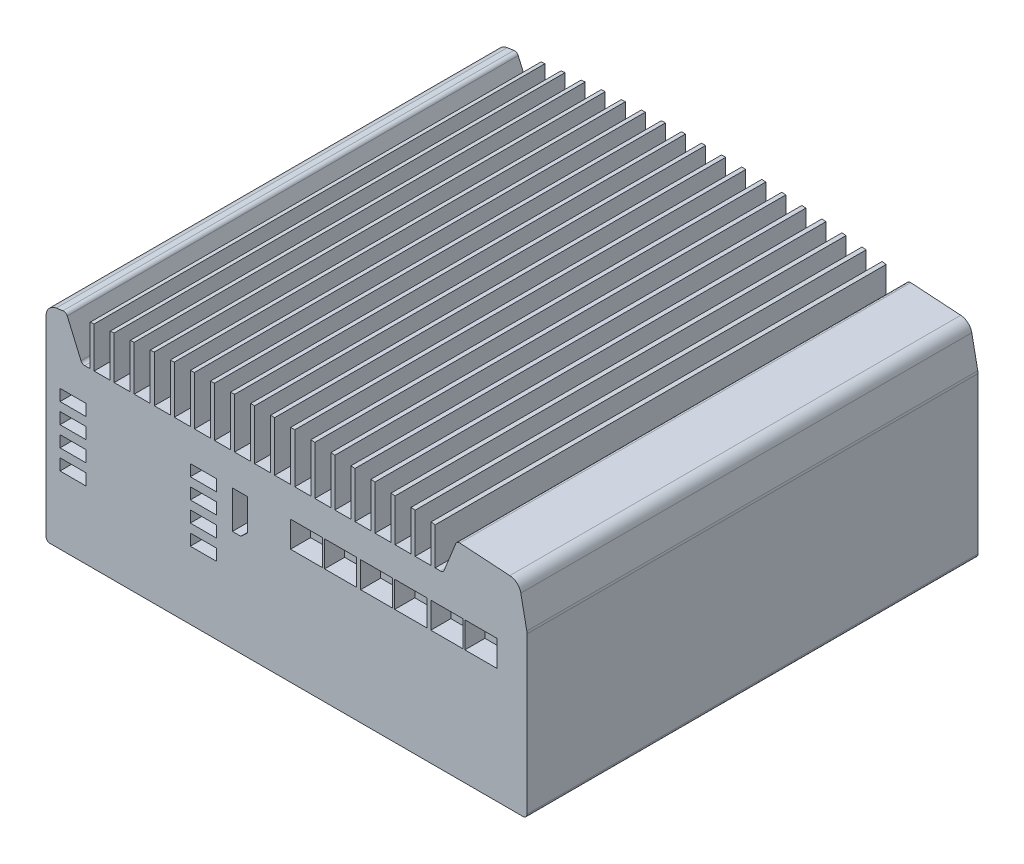
from build123d import *

# Parameters (mm, degrees)
ESQUISSE1_W             = 13
ESQUISSE1_H             = 5.7
ESQUISSE1_W_2           = 16
ESQUISSE1_H_2           = 13
BOSS_EXTRU_1_DEPTH      = 10
CONG_1_R                = 6
CONG_2_R                = 2
BOSS_EXTRU_2_START      = 215
BOSS_EXTRU_2_DEPTH      = 215
ESQUISSE3_R             = 1.6
ESQUISSE3_W             = 24
ESQUISSE3_H             = 8
ENL_V_MAT_EXTRU_1_DEPTH = 10
CONG_3_R                = 2
ESQUISSE4_R             = 1.65
ENL_V_MAT_EXTRU_2_DEPTH = 10


with BuildPart() as part:
    # Esquisse1 → Boss.-Extru.1 (new body)
    with BuildSketch(Plane.XY):
        Polygon((0, 0), (0, 102.5), (10, 103.992224963), (18, 85.5), (22, 85.5), (22, 105.577138524), (24, 105.81957608), (24, 85.5), (32, 85.5), (32, 106.727539399), (34.003461675, 106.939476386), (34.003461675, 85.5), (42.003461675, 85.5), (42.003461675, 107.724257974), (44.00991635, 107.905684552), (44.00991635, 85.5), (52.00991635, 85.5), (52.00991635, 108.567798245), (54.018896892, 108.718705997), (54.018896892, 85.5), (62.018896892, 85.5), (62.018896892, 109.258583137), (64.029937459, 109.378965072), (64.029937459, 85.5), (72.029937459, 85.5), (72.029937459, 109.796955904), (74.042573255, 109.886806448), (74.042573255, 85.5), (82.042573255, 85.5), (82.042573255, 110.183181243), (84.056340297, 110.242496239), (84.056340297, 85.5), (92.056340297, 85.5), (92.056340297, 110.417446158), (94.070775173, 110.446222863), (94.070775173, 85.5), (102.070775173, 85.5), (102.070775173, 110.499860564), (104.085414808, 110.498097647), (104.085414808, 85.5), (112.085414808, 85.5), (112.085414808, 110.430457642), (114.099796232, 110.398155185), (114.099796232, 85.5), (122.099796232, 85.5), (122.099796232, 110.209193951), (124.113456342, 110.146353446), (124.113456342, 85.5), (132.113456342, 85.5), (132.113456342, 109.835949284), (134.125931673, 109.742573639), (134.125931673, 85.5), (142.125931673, 85.5), (142.125931673, 109.310526291), (144.136758159, 109.186619826), (144.136758159, 85.5), (152.136758159, 85.5), (152.136758159, 108.632649837), (154.145470898, 108.47821829), (154.145470898, 85.5), (162.145470898, 85.5), (162.145470898, 107.801966114), (164.151603909, 107.61701664), (164.151603909, 85.5), (172.151603909, 85.5), (172.151603909, 106.818041488), (174.154689895, 106.602582667), (174.154689895, 85.5), (182.154689895, 85.5), (182.154689895, 105.680361076), (184.154259986, 105.434402916), (184.154259986, 85.5), (192.154259986, 85.5), (192.154259986, 104.388327046), (194.149843496, 104.111880985), (194.149843496, 85.5), (198.149843496, 85.5), (205, 102.5), (236, 100.5), (240, 80.5), (240, 0), align=None)
        with Locations((78.5, 66.65)):
            Rectangle(ESQUISSE1_W, ESQUISSE1_H, mode=Mode.SUBTRACT)
        with Locations((130, 64)):
            Rectangle(ESQUISSE1_W_2, ESQUISSE1_H_2, mode=Mode.SUBTRACT)
        with Locations((147, 64)):
            Rectangle(ESQUISSE1_W_2, ESQUISSE1_H_2, mode=Mode.SUBTRACT)
        with Locations((165, 64)):
            Rectangle(ESQUISSE1_W_2, ESQUISSE1_H_2, mode=Mode.SUBTRACT)
        with Locations((182, 64)):
            Rectangle(ESQUISSE1_W_2, ESQUISSE1_H_2, mode=Mode.SUBTRACT)
        with Locations((200, 64)):
            Rectangle(ESQUISSE1_W_2, ESQUISSE1_H_2, mode=Mode.SUBTRACT)
        with Locations((217, 64)):
            Rectangle(ESQUISSE1_W_2, ESQUISSE1_H_2, mode=Mode.SUBTRACT)
        with Locations((13.5, 66.65)):
            Rectangle(ESQUISSE1_W, ESQUISSE1_H, mode=Mode.SUBTRACT)
        with Locations((78.5, 56.65)):
            Rectangle(ESQUISSE1_W, ESQUISSE1_H, mode=Mode.SUBTRACT)
        with Locations((78.5, 46.65)):
            Rectangle(ESQUISSE1_W, ESQUISSE1_H, mode=Mode.SUBTRACT)
        with Locations((78.5, 36.65)):
            Rectangle(ESQUISSE1_W, ESQUISSE1_H, mode=Mode.SUBTRACT)
        with Locations((13.5, 56.65)):
            Rectangle(ESQUISSE1_W, ESQUISSE1_H, mode=Mode.SUBTRACT)
        with Locations((13.5, 46.65)):
            Rectangle(ESQUISSE1_W, ESQUISSE1_H, mode=Mode.SUBTRACT)
        with Locations((13.5, 36.65)):
            Rectangle(ESQUISSE1_W, ESQUISSE1_H, mode=Mode.SUBTRACT)
        Polygon((93, 69.5), (93, 50.7), (97.2, 50.7), (100.6, 53.8), (100.6, 69.5), align=None, mode=Mode.SUBTRACT)
    extrude(amount=-BOSS_EXTRU_1_DEPTH)

    # Congé1
    cong_1_edges = [part.edges().sort_by_distance(p)[0] for p in [
        (236, 100.5, -5),
        (240, 80.5, -5),
        (0, 102.5, -5),
    ]]
    fillet(cong_1_edges, radius=CONG_1_R)

    # Congé2
    cong_2_edges = [part.edges().sort_by_distance(p)[0] for p in [
        (10, 103.992224963, -5),
        (18, 85.5, -5),
        (198.149843496, 85.5, -5),
        (205, 102.5, -5),
        (240, 0, -5),
        (0, 0, -5),
    ]]
    fillet(cong_2_edges, radius=CONG_2_R)

    # Esquisse2 → Boss.-Extru.2 (add)
    with BuildSketch(Plane(origin=(0, 0, -10), x_dir=(-1, 0, 0), z_dir=(0, 0, -1)).offset(BOSS_EXTRU_2_START)):
        with BuildLine():
            Line((-238, 0), (-2, 0))
            ThreePointArc((-2, 0), (-0.585786438, 0.585786438), (0, 2))
            Line((0, 2), (0, 97.32890071))
            ThreePointArc((0, 97.32890071), (-1.455047837, 101.245967194), (-5.114469946, 103.263193972))
            Line((-5.114469946, 103.263193972), (-8.479594606, 103.765346274))
            ThreePointArc((-8.479594606, 103.765346274), (-9.746203645, 103.53548168), (-10.610363757, 102.581351975))
            Line((-10.610363757, 102.581351975), (-17.478311973, 86.705896545))
            ThreePointArc((-17.478311973, 86.705896545), (-18.21577123, 85.828442805), (-19.313904439, 85.5))
            Line((-19.313904439, 85.5), (-22, 85.5))
            Line((-22, 85.5), (-22, 105.577138524))
            Line((-22, 105.577138524), (-24, 105.81957608))
            Line((-24, 105.81957608), (-24, 85.5))
            Line((-24, 85.5), (-32, 85.5))
            Line((-32, 85.5), (-32, 106.727539399))
            Line((-32, 106.727539399), (-34.003461675, 106.939476386))
            Line((-34.003461675, 106.939476386), (-34.003461675, 85.5))
            Line((-34.003461675, 85.5), (-42.003461675, 85.5))
            Line((-42.003461675, 85.5), (-42.003461675, 107.724257974))
            Line((-42.003461675, 107.724257974), (-44.00991635, 107.905684552))
            Line((-44.00991635, 107.905684552), (-44.00991635, 85.5))
            Line((-44.00991635, 85.5), (-52.00991635, 85.5))
            Line((-52.00991635, 85.5), (-52.00991635, 108.567798245))
            Line((-52.00991635, 108.567798245), (-54.018896892, 108.718705997))
            Line((-54.018896892, 108.718705997), (-54.018896892, 85.5))
            Line((-54.018896892, 85.5), (-62.018896892, 85.5))
            Line((-62.018896892, 85.5), (-62.018896892, 109.258583137))
            Line((-62.018896892, 109.258583137), (-64.029937459, 109.378965072))
            Line((-64.029937459, 109.378965072), (-64.029937459, 85.5))
            Line((-64.029937459, 85.5), (-72.029937459, 85.5))
            Line((-72.029937459, 85.5), (-72.029937459, 109.796955904))
            Line((-72.029937459, 109.796955904), (-74.042573255, 109.886806448))
            Line((-74.042573255, 109.886806448), (-74.042573255, 85.5))
            Line((-74.042573255, 85.5), (-82.042573255, 85.5))
            Line((-82.042573255, 85.5), (-82.042573255, 110.183181243))
            Line((-82.042573255, 110.183181243), (-84.056340297, 110.242496239))
            Line((-84.056340297, 110.242496239), (-84.056340297, 85.5))
            Line((-84.056340297, 85.5), (-92.056340297, 85.5))
            Line((-92.056340297, 85.5), (-92.056340297, 110.417446158))
            Line((-92.056340297, 110.417446158), (-94.070775173, 110.446222863))
            Line((-94.070775173, 110.446222863), (-94.070775173, 85.5))
            Line((-94.070775173, 85.5), (-102.070775173, 85.5))
            Line((-102.070775173, 85.5), (-102.070775173, 110.499860564))
            Line((-102.070775173, 110.499860564), (-104.085414808, 110.498097647))
            Line((-104.085414808, 110.498097647), (-104.085414808, 85.5))
            Line((-104.085414808, 85.5), (-112.085414808, 85.5))
            Line((-112.085414808, 85.5), (-112.085414808, 110.430457642))
            Line((-112.085414808, 110.430457642), (-114.099796232, 110.398155185))
            Line((-114.099796232, 110.398155185), (-114.099796232, 85.5))
            Line((-114.099796232, 85.5), (-122.099796232, 85.5))
            Line((-122.099796232, 85.5), (-122.099796232, 110.209193951))
            Line((-122.099796232, 110.209193951), (-124.113456342, 110.146353446))
            Line((-124.113456342, 110.146353446), (-124.113456342, 85.5))
            Line((-124.113456342, 85.5), (-132.113456342, 85.5))
            Line((-132.113456342, 85.5), (-132.113456342, 109.835949284))
            Line((-132.113456342, 109.835949284), (-134.125931673, 109.742573639))
            Line((-134.125931673, 109.742573639), (-134.125931673, 85.5))
            Line((-134.125931673, 85.5), (-142.125931673, 85.5))
            Line((-142.125931673, 85.5), (-142.125931673, 109.310526291))
            Line((-142.125931673, 109.310526291), (-144.136758159, 109.186619826))
            Line((-144.136758159, 109.186619826), (-144.136758159, 85.5))
            Line((-144.136758159, 85.5), (-152.136758159, 85.5))
            Line((-152.136758159, 85.5), (-152.136758159, 108.632649837))
            Line((-152.136758159, 108.632649837), (-154.145470898, 108.47821829))
            Line((-154.145470898, 108.47821829), (-154.145470898, 85.5))
            Line((-154.145470898, 85.5), (-162.145470898, 85.5))
            Line((-162.145470898, 85.5), (-162.145470898, 107.801966114))
            Line((-162.145470898, 107.801966114), (-164.151603909, 107.61701664))
            Line((-164.151603909, 107.61701664), (-164.151603909, 85.5))
            Line((-164.151603909, 85.5), (-172.151603909, 85.5))
            Line((-172.151603909, 85.5), (-172.151603909, 106.818041488))
            Line((-172.151603909, 106.818041488), (-174.154689895, 106.602582667))
            Line((-174.154689895, 106.602582667), (-174.154689895, 85.5))
            Line((-174.154689895, 85.5), (-182.154689895, 85.5))
            Line((-182.154689895, 85.5), (-182.154689895, 105.680361076))
            Line((-182.154689895, 105.680361076), (-184.154259986, 105.434402916))
            Line((-184.154259986, 105.434402916), (-184.154259986, 85.5))
            Line((-184.154259986, 85.5), (-192.154259986, 85.5))
            Line((-192.154259986, 85.5), (-192.154259986, 104.388327046))
            Line((-192.154259986, 104.388327046), (-194.149843496, 104.111880985))
            Line((-194.149843496, 104.111880985), (-194.149843496, 85.5))
            Line((-194.149843496, 85.5), (-196.799479889, 85.5))
            ThreePointArc((-196.799479889, 85.5), (-197.918632614, 85.842442406), (-198.654539988, 86.752502823))
            Line((-198.654539988, 86.752502823), (-204.459454856, 101.158531752))
            ThreePointArc((-204.459454856, 101.158531752), (-205.249329218, 102.103777717), (-206.443279511, 102.406885193))
            Line((-206.443279511, 102.406885193), (-231.405699323, 100.796406495))
            ThreePointArc((-231.405699323, 100.796406495), (-234.9708117, 99.323983684), (-236.90288971, 95.985551452))
            Line((-236.90288971, 95.985551452), (-239.883484054, 81.082579729))
            ThreePointArc((-239.883484054, 81.082579729), (-239.97079996, 80.497108626), (-240, 79.905882918))
            Line((-240, 79.905882918), (-240, 2))
            ThreePointArc((-240, 2), (-239.414213562, 0.585786438), (-238, 0))
        make_face()
    extrude(amount=-BOSS_EXTRU_2_DEPTH)

    # Esquisse3 → Enlèv. mat.-Extru.1 (cut)
    with BuildSketch(Plane(origin=(0, 0, -225), x_dir=(-1, 0, 0), z_dir=(0, 0, -1))):
        with Locations((-37, 65.5)):
            Circle(ESQUISSE3_R)
        with Locations(Location((-62, 65.5, 0), (0, 0, 180))):
            Circle(ESQUISSE3_R)
        with Locations((-69, 65.5)):
            Circle(ESQUISSE3_R)
        with Locations(Location((-94, 65.5, 0), (0, 0, 180))):
            Circle(ESQUISSE3_R)
        with Locations(Location((-134, 65.5, 0), (0, 0, 180))):
            Circle(ESQUISSE3_R)
        with Locations((-109, 65.5)):
            Circle(ESQUISSE3_R)
        with Locations(Location((-62, 45.5, 0), (0, 0, 180))):
            Circle(ESQUISSE3_R)
        with Locations((-37, 45.5)):
            Circle(ESQUISSE3_R)
        Polygon((-58, 70.5), (-59, 60.5), (-40, 60.5), (-41, 70.5), align=None)
        Polygon((-90, 70.5), (-91, 60.5), (-72, 60.5), (-73, 70.5), align=None)
        Polygon((-113, 70.5), (-130, 70.5), (-131, 60.5), (-112, 60.5), align=None)
        Polygon((-58, 50.5), (-59, 40.5), (-40, 40.5), (-41, 50.5), align=None)
        with Locations((-17, 47.5)):
            Rectangle(ESQUISSE3_W, ESQUISSE3_H)
        with Locations((-17, 67.5)):
            Rectangle(ESQUISSE3_W, ESQUISSE3_H)
    extrude(amount=-ENL_V_MAT_EXTRU_1_DEPTH, mode=Mode.SUBTRACT)

    # Congé3
    cong_3_edges = [part.edges().sort_by_distance(p)[0] for p in [
        (131, 60.5, -220),
        (130, 70.5, -220),
        (113, 70.5, -220),
        (112, 60.5, -220),
        (90, 70.5, -220),
        (73, 70.5, -220),
        (72, 60.5, -220),
        (91, 60.5, -220),
        (58, 50.5, -220),
        (41, 50.5, -220),
        (40, 40.5, -220),
        (59, 40.5, -220),
        (58, 70.5, -220),
        (41, 70.5, -220),
        (40, 60.5, -220),
        (59, 60.5, -220),
    ]]
    fillet(cong_3_edges, radius=CONG_3_R)

    # Esquisse4 → Enlèv. mat.-Extru.2 (cut)
    with BuildSketch(Plane.XZ):
        with Locations((228, -200)):
            Circle(ESQUISSE4_R)
        with Locations((228, -25)):
            Circle(ESQUISSE4_R)
        with Locations((12, -200)):
            Circle(ESQUISSE4_R)
        with Locations((12, -25)):
            Circle(ESQUISSE4_R)
    extrude(amount=-ENL_V_MAT_EXTRU_2_DEPTH, mode=Mode.SUBTRACT)


solid = part.part
